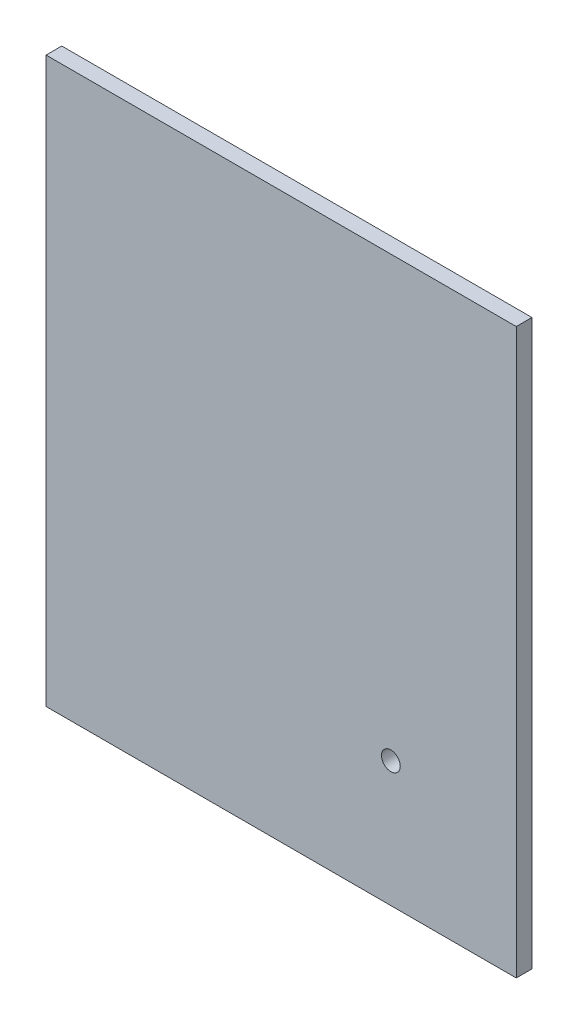
from build123d import *

# Parameters (mm, degrees)
BOSS_EXTRUDE1_DEPTH = 5


with BuildPart() as part:
    # Sketch1 → Boss-Extrude1 (new body)
    with BuildSketch(Plane.XY):
        with BuildLine():
            Line((38, -50), (75, -50))
            Line((75, -50), (75, 90))
            Line((75, 90), (-75, 90))
            Line((-75, 90), (-75, -50))
            Line((-75, -50), (32, -50))
            ThreePointArc((32, -50), (35, -47), (38, -50))
        make_face()
        with BuildLine():
            Line((-75, -90), (75, -90))
            Line((75, -90), (75, -50))
            Line((75, -50), (38, -50))
            ThreePointArc((38, -50), (35, -53), (32, -50))
            Line((32, -50), (-75, -50))
            Line((-75, -50), (-75, -90))
        make_face()
    extrude(amount=BOSS_EXTRUDE1_DEPTH)


solid = part.part
